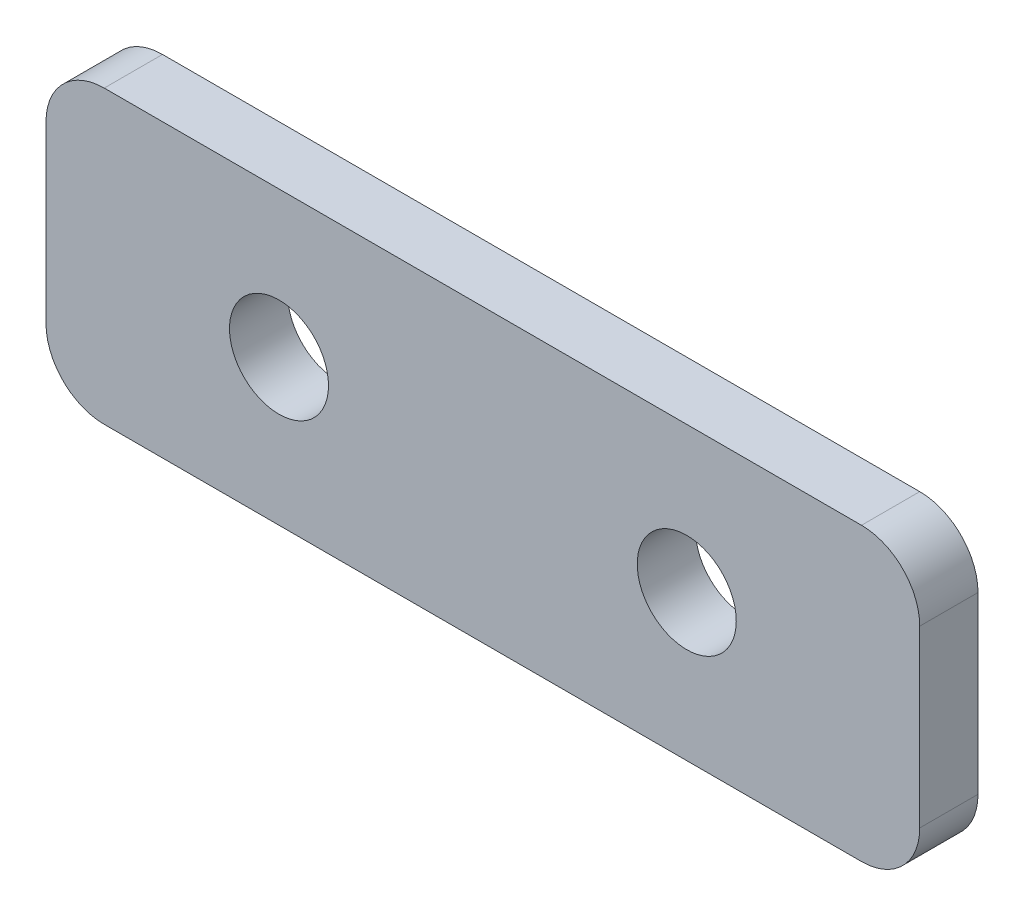
from build123d import *

# Parameters (mm, degrees)
SKETCH1_W            = 30
SKETCH1_H            = 10
BOSS_EXTRUDE1_DEPTH  = 2
M3_CLEARANCE_HOLE1_D = 3.4
FILLET1_R            = 2


with BuildPart() as part:
    # Sketch1 → Boss-Extrude1 (new body)
    with BuildSketch(Plane.XY):
        Rectangle(SKETCH1_W, SKETCH1_H)
    extrude(amount=BOSS_EXTRUDE1_DEPTH)

    # M3 Clearance Hole1 (through all)
    with Locations(Plane.XY.offset(2)):
        with Locations((-7, 0), (7, 0)):
            Hole(M3_CLEARANCE_HOLE1_D / 2)

    # Fillet1
    fillet1_edges = [part.edges().sort_by_distance(p)[0] for p in [
        (15, -5, 1),
        (-15, -5, 1),
        (-15, 5, 1),
        (15, 5, 1),
    ]]
    fillet(fillet1_edges, radius=FILLET1_R)


solid = part.part
